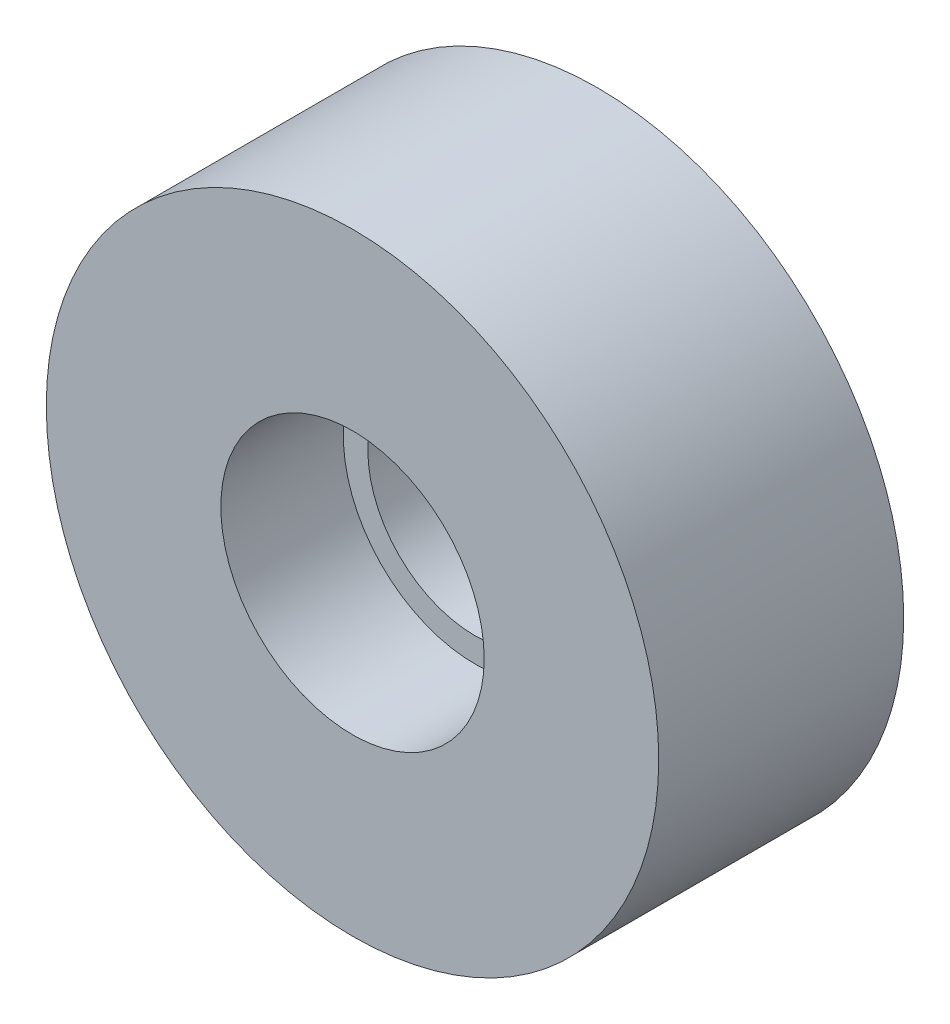
from build123d import *

# Parameters (mm, degrees)
ESQUISSE1_R             = 5
BOSS_EXTRU_1_DEPTH      = 4
ESQUISSE2_R             = 2.15
ENL_V_MAT_EXTRU_1_DEPTH = 2
ESQUISSE3_R             = 1.75
ENL_V_MAT_EXTRU_2_DEPTH = 9.124038405


with BuildPart() as part:
    # Esquisse1 → Boss.-Extru.1 (new body)
    with BuildSketch(Plane.XY):
        Circle(ESQUISSE1_R)
    extrude(amount=BOSS_EXTRU_1_DEPTH)

    # Esquisse2 → Enlèv. mat.-Extru.1 (cut)
    with BuildSketch(Plane.XY.offset(4)):
        Circle(ESQUISSE2_R)
    extrude(amount=-ENL_V_MAT_EXTRU_1_DEPTH, mode=Mode.SUBTRACT)

    # Esquisse3 → Enlèv. mat.-Extru.2 (cut, through all)
    with BuildSketch(Plane(origin=(0, 0, 0), x_dir=(-1, 0, 0), z_dir=(0, 0, -1))):
        Circle(ESQUISSE3_R)
    extrude(amount=-ENL_V_MAT_EXTRU_2_DEPTH, mode=Mode.SUBTRACT)


solid = part.part
